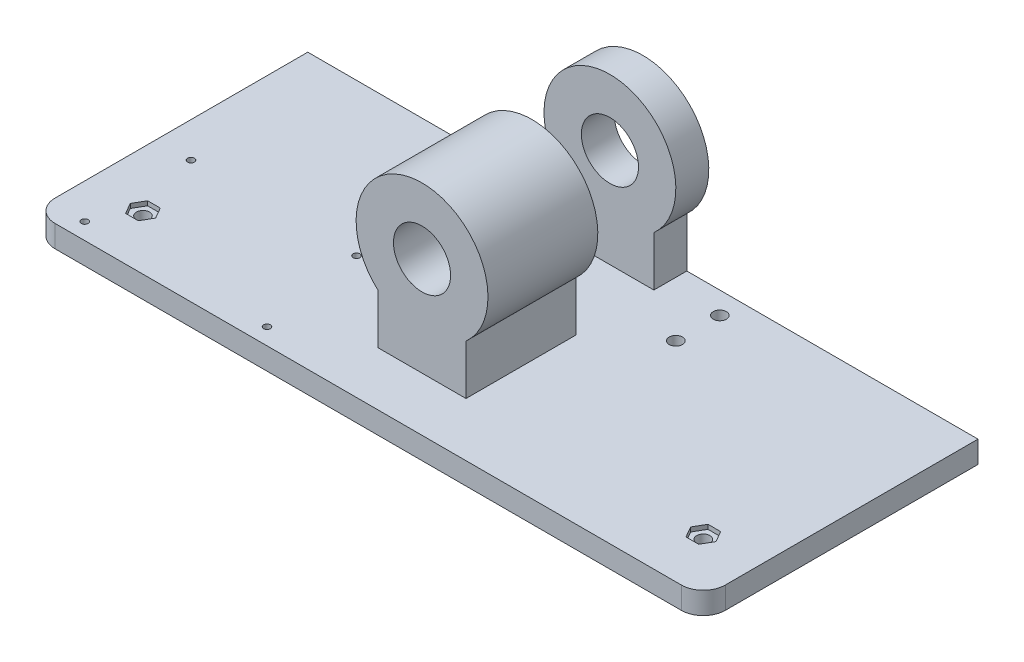
from build123d import *

# Parameters (mm, degrees)
SKETCH1_W           = 305
SKETCH1_H           = 125
SKETCH1_R           = 3
BOSS_EXTRUDE1_DEPTH = 10
SKETCH7_W           = 40
SKETCH7_H           = 50
SKETCH7_H_2         = 15
BOSS_EXTRUDE2_DEPTH = 22.639320225
BOSS_EXTRUDE3_REACH = 324.786
SKETCH11_R          = 30
SKETCH11_R_2        = 13
SKETCH12_W          = 35.5
SKETCH12_H          = 75
CUT_EXTRUDE2_DEPTH  = 341.404171537
CUT_EXTRUDE1_DEPTH  = 2
SKETCH16_R          = 1.55
CUT_EXTRUDE3_DEPTH  = 339.045854878
FILLET3_R           = 10
CHAMFER2_SIZE       = 1.65


with BuildPart() as part:
    # Sketch1 → Boss-Extrude1 (new body)
    with BuildSketch(Plane(origin=(0, 0, 0), x_dir=(1, 0, 0), z_dir=(0, 1, 0))):
        with Locations((152.5, 62.5)):
            Rectangle(SKETCH1_W, SKETCH1_H)
        with Locations(Location((280, 25, 0), (0, 0, 270))):
            Circle(SKETCH1_R, mode=Mode.SUBTRACT)
        with Locations(Location((25, 25, 0), (0, 0, 90))):
            Circle(SKETCH1_R, mode=Mode.SUBTRACT)
        with Locations(Location((107.5, 115, 0), (0, 0, 270))):
            Circle(SKETCH1_R, mode=Mode.SUBTRACT)
        with Locations(Location((107.5, 95, 0), (0, 0, 270))):
            Circle(SKETCH1_R, mode=Mode.SUBTRACT)
        with Locations(Location((197.5, 115, 0), (0, 0, 90))):
            Circle(SKETCH1_R, mode=Mode.SUBTRACT)
        with Locations(Location((197.5, 95, 0), (0, 0, 90))):
            Circle(SKETCH1_R, mode=Mode.SUBTRACT)
    extrude(amount=BOSS_EXTRUDE1_DEPTH)

    # Sketch7 → Boss-Extrude2 (add)
    with BuildSketch(Plane(origin=(0, 10, 0), x_dir=(1, 0, 0), z_dir=(0, 1, 0))):
        with Locations((152.5, 49.5)):
            Rectangle(SKETCH7_W, SKETCH7_H)
        with Locations((152.5, 117.5)):
            Rectangle(SKETCH7_W, SKETCH7_H_2)
    extrude(amount=BOSS_EXTRUDE2_DEPTH)

    # Boss-Extrude3: up to this face of the body (flat: up to its plane)
    boss_extrude3_end = Plane(part.part.faces().sort_by_distance((152.5, 8.736156851, -125))[0])
    # Sketch11 → Boss-Extrude3 (add, up to the picked face)
    with BuildSketch(Plane.XY.offset(-24.5), mode=Mode.PRIVATE) as boss_extrude3_sk1:
        with Locations(Location((152.5, 55, 0), (0, 0, 311.810314896))):
            Circle(SKETCH11_R)
        with Locations((152.5, 55)):
            Circle(SKETCH11_R_2, mode=Mode.SUBTRACT)
    boss_extrude3_tool1 = split(extrude(boss_extrude3_sk1.sketch, amount=-BOSS_EXTRUDE3_REACH, mode=Mode.PRIVATE), bisect_by=boss_extrude3_end, keep=Keep.BOTH, mode=Mode.PRIVATE)
    add(boss_extrude3_tool1.solids().sort_by(Axis((133.065685, 76.728224, -24.5), (0, 0, -1)))[0])

    # Sketch12 → Cut-Extrude2 (cut, through all)
    with BuildSketch(Plane(origin=(305, 0, 0), x_dir=(0, 0, -1), z_dir=(1, 0, 0))):
        with Locations((92.25, 47.5)):
            Rectangle(SKETCH12_W, SKETCH12_H)
    extrude(amount=-CUT_EXTRUDE2_DEPTH, mode=Mode.SUBTRACT)

    # Sketch6 → Cut-Extrude1 (cut)
    with BuildSketch(Plane(origin=(0, 10, 0), x_dir=(1, 0, 0), z_dir=(0, 1, 0))):
        Polygon((27.886751346, 30), (30.773502692, 25), (27.886751346, 20), (22.113248654, 20), (19.226497308, 25), (22.113248654, 30), align=None)
        Polygon((274.226497308, 25), (277.113248654, 20), (282.886751346, 20), (285.773502692, 25), (282.886751346, 30), (277.113248654, 30), align=None)
    extrude(amount=-CUT_EXTRUDE1_DEPTH, mode=Mode.SUBTRACT)

    # Sketch16 → Cut-Extrude3 (cut, through all)
    with BuildSketch(Plane(origin=(0, 10, 0), x_dir=(1, 0, 0), z_dir=(0, 1, 0))):
        with Locations(Location((16, 7.5, 0), (0, 0, 270))):
            Circle(SKETCH16_R)
        with Locations(Location((98.95, 7.5, 0), (0, 0, 270))):
            Circle(SKETCH16_R)
        with Locations(Location((16, 55.866, 0), (0, 0, 270))):
            Circle(SKETCH16_R)
        with Locations(Location((91.33, 55.866, 0), (0, 0, 270))):
            Circle(SKETCH16_R)
    extrude(amount=-CUT_EXTRUDE3_DEPTH, mode=Mode.SUBTRACT)

    # Fillet3
    fillet3_edges = [part.edges().sort_by_distance(p)[0] for p in [
        (305, 5, 0),
        (0, 5, 0),
    ]]
    fillet(fillet3_edges, radius=FILLET3_R)

    # Chamfer2
    chamfer2_edges = [part.edges().sort_by_distance(p)[0] for p in [
        (98.95, 0, -9.05),
        (16, 0, -57.416),
        (91.33, 0, -57.416),
        (16, 0, -9.05),
    ]]
    chamfer(chamfer2_edges, length=CHAMFER2_SIZE)


solid = part.part
